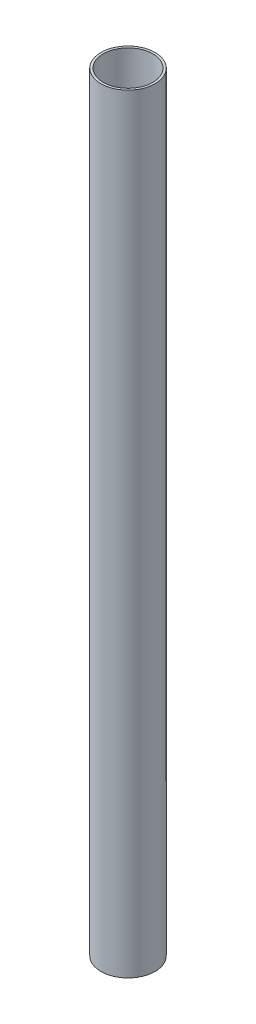
from build123d import *

# Parameters (mm, degrees)
SKETCH1_R           = 15.875
SKETCH1_R_2         = 14.5288
EXTRUDE_THIN1_DEPTH = 450.85


with BuildPart() as part:
    # Sketch1 → Extrude-Thin1 (new body)
    with BuildSketch(Plane(origin=(0, 0, 0), x_dir=(1, 0, 0), z_dir=(0, 1, 0))):
        Circle(SKETCH1_R)
        Circle(SKETCH1_R_2, mode=Mode.SUBTRACT)
    extrude(amount=EXTRUDE_THIN1_DEPTH)


solid = part.part
